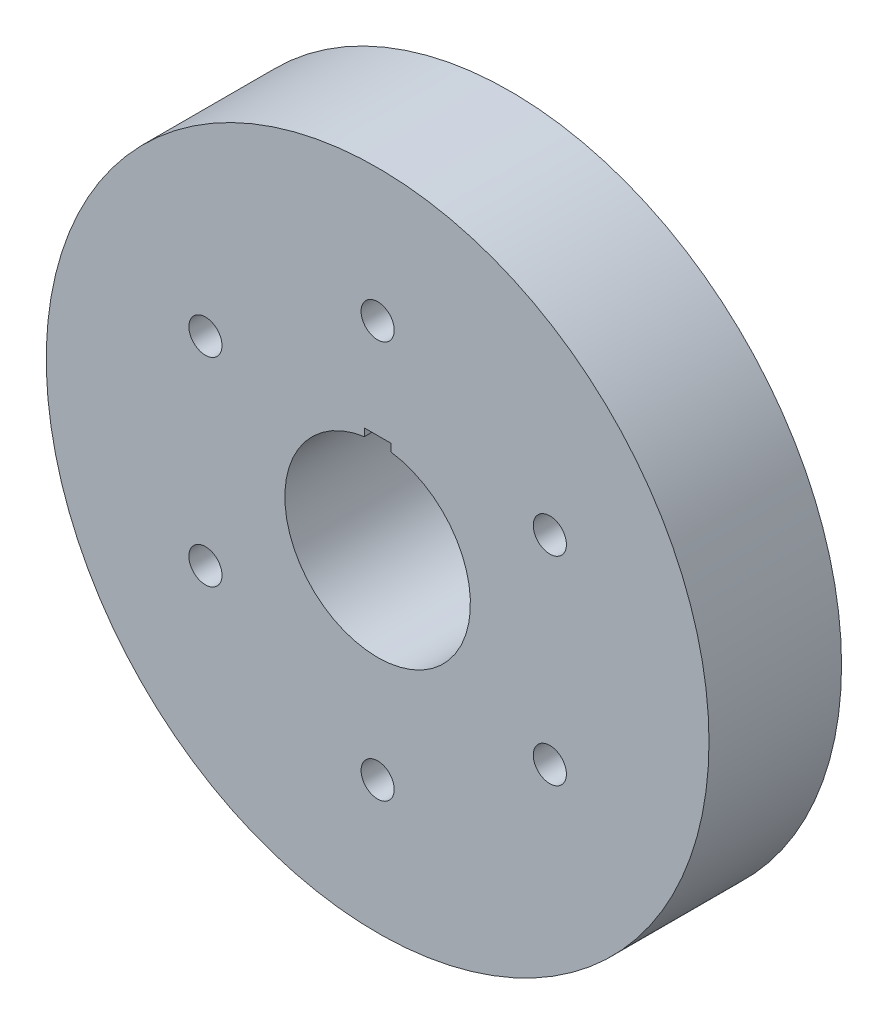
from build123d import *

# Parameters (mm, degrees)
SKETCH1_R           = 50
BOSS_EXTRUDE1_DEPTH = 20
SKETCH2_R           = 2.5
CUT_EXTRUDE1_DEPTH  = 74.484692283


with BuildPart() as part:
    # Sketch1 → Boss-Extrude1 (new body)
    with BuildSketch(Plane.XY):
        Circle(SKETCH1_R)
        with BuildLine():
            Line((-2, 13.856406461), (-2, 15))
            Line((-2, 15), (2, 15))
            Line((2, 15), (2, 13.856406461))
            ThreePointArc((2, 13.856406461), (0, -14), (-2, 13.856406461))
        make_face(mode=Mode.SUBTRACT)
    extrude(amount=BOSS_EXTRUDE1_DEPTH)

    # Sketch2 → Cut-Extrude1 (cut, through all)
    with BuildSketch(Plane.XY.offset(20)):
        with Locations((0, -30)):
            Circle(SKETCH2_R)
        with Locations((-25.980762114, -15)):
            Circle(SKETCH2_R)
        with Locations((-25.980762114, 15)):
            Circle(SKETCH2_R)
        with Locations((0, 30)):
            Circle(SKETCH2_R)
        with Locations((25.980762114, 15)):
            Circle(SKETCH2_R)
        with Locations((25.980762114, -15)):
            Circle(SKETCH2_R)
    extrude(amount=-CUT_EXTRUDE1_DEPTH, mode=Mode.SUBTRACT)


solid = part.part
